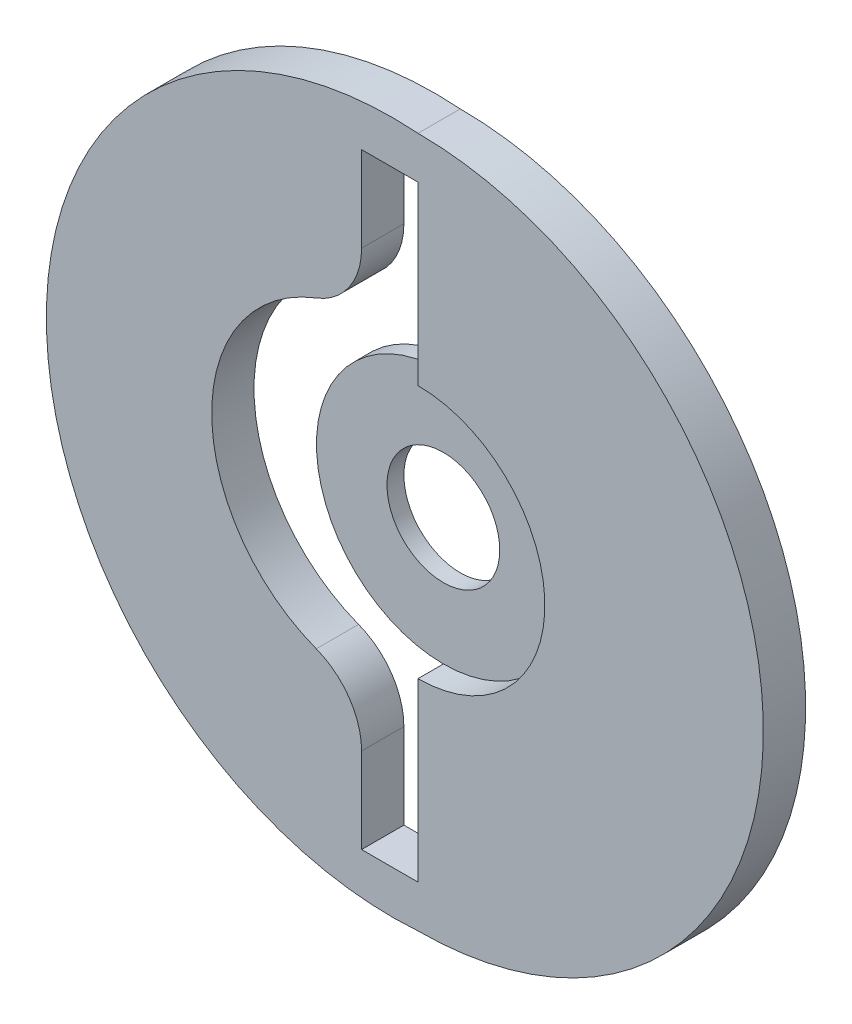
from build123d import *

# Parameters (mm, degrees)
SALIENTE_EXTRUIR1_DEPTH = 3
CROQUIS2_R              = 9
CORTAR_EXTRUIR1_DEPTH   = 1.8
SALIENTE_EXTRUIR2_DEPTH = 1.2
SALIENTE_EXTRUIR3_DEPTH = 3
REDONDEO1_R             = 5


with BuildPart() as part:
    # Croquis1 → Saliente-Extruir1 (new body)
    with BuildSketch(Plane.XY):
        with BuildLine():
            Line((-39.310376575, -0.627009646), (-39.310376575, 19.872990354))
            ThreePointArc((-39.310376575, 19.872990354), (-14.810376575, -4.627009646), (-39.310376575, -29.127009646))
            Line((-39.310376575, -29.127009646), (-39.310376575, -8.627009646))
            ThreePointArc((-39.310376575, -8.627009646), (-35.310376575, -4.627009646), (-39.310376575, -0.627009646))
        make_face()
    extrude(amount=SALIENTE_EXTRUIR1_DEPTH)

    # Croquis2 → Cortar-Extruir1 (cut)
    with BuildSketch(Plane.XY.offset(3)):
        with Locations((-39.310376575, -4.627009646)):
            Circle(CROQUIS2_R)
    extrude(amount=-CORTAR_EXTRUIR1_DEPTH, mode=Mode.SUBTRACT)

    # Croquis3 → Saliente-Extruir2 (add)
    with BuildSketch(Plane.XY.offset(1.2)):
        with BuildLine():
            Line((-39.310376575, 4.372990354), (-39.310376575, -0.627009646))
            ThreePointArc((-39.310376575, -0.627009646), (-43.310376575, -4.627009646), (-39.310376575, -8.627009646))
            Line((-39.310376575, -8.627009646), (-39.310376575, -13.627009646))
            ThreePointArc((-39.310376575, -13.627009646), (-48.310376575, -4.627009646), (-39.310376575, 4.372990354))
        make_face()
    extrude(amount=-SALIENTE_EXTRUIR2_DEPTH)

    # Croquis4 → Saliente-Extruir3 (add)
    with BuildSketch(Plane.XY.offset(3)):
        with BuildLine():
            Line((-39.310376575, 19.872990354), (-39.310376575, 16.872990354))
            Line((-39.310376575, 16.872990354), (-43.310376575, 16.872990354))
            Line((-43.310376575, 16.872990354), (-43.310376575, 6.872990354))
            ThreePointArc((-43.310376575, 6.872990354), (-53.943204224, -4.627009646), (-43.310376575, -16.127009646))
            Line((-43.310376575, -16.127009646), (-43.310376575, -26.127009646))
            Line((-43.310376575, -26.127009646), (-39.310376575, -26.127009646))
            Line((-39.310376575, -26.127009646), (-39.310376575, -29.127009646))
            ThreePointArc((-39.310376575, -29.127009646), (-65.673236128, -4.627009646), (-39.310376575, 19.872990354))
        make_face()
    extrude(amount=-SALIENTE_EXTRUIR3_DEPTH)

    # Redondeo1
    redondeo1_edges = [part.edges().sort_by_distance(p)[0] for p in [
        (-43.310376575, 6.872990354, 1.5),
        (-43.310376575, -16.127009646, 1.5),
    ]]
    fillet(redondeo1_edges, radius=REDONDEO1_R)


solid = part.part
